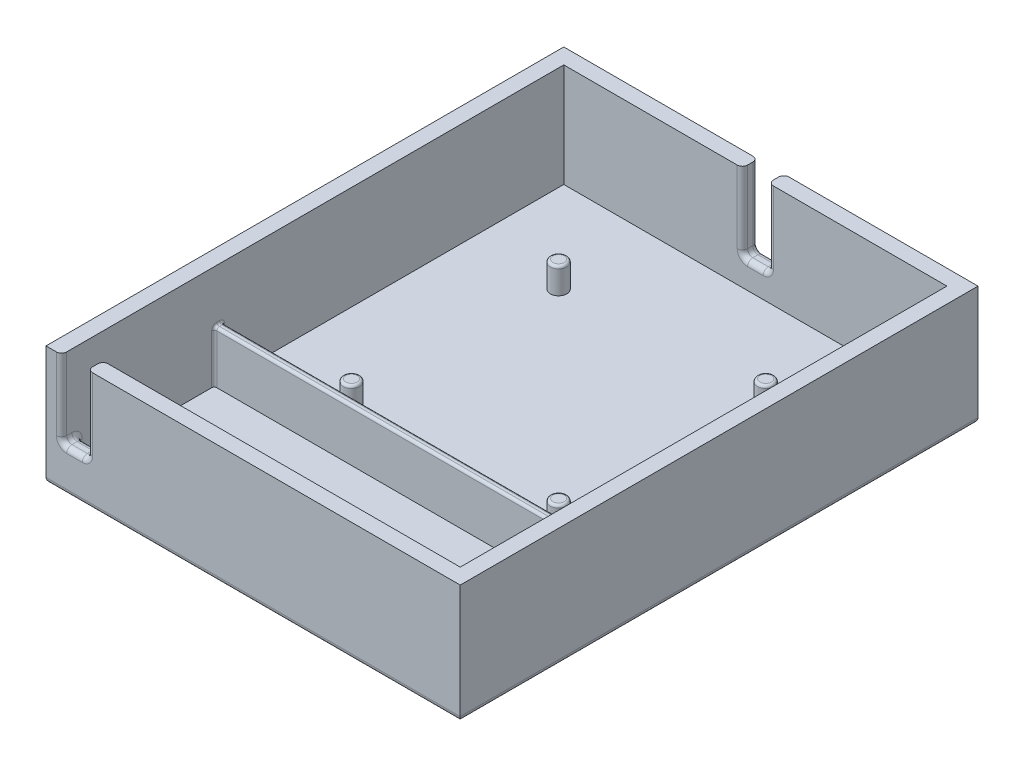
from build123d import *

# Parameters (mm, degrees)
SKETCH1_W           = 80
SKETCH1_H           = 100
BOSS_EXTRUDE1_DEPTH = 3
SKETCH2_W           = 80
SKETCH2_H           = 100
SKETCH2_W_2         = 74
SKETCH2_H_2         = 94
BOSS_EXTRUDE2_DEPTH = 20
SKETCH3_R           = 1.6
BOSS_EXTRUDE3_DEPTH = 5
SKETCH4_W           = 74
SKETCH4_H           = 1.5
BOSS_EXTRUDE4_DEPTH = 10
SKETCH6_W           = 5
SKETCH6_H           = 3
SKETCH6_H_2         = 8.17035569
CUT_EXTRUDE1_DEPTH  = 15
FILLET1_R           = 1
FILLET2_R           = 0.5
FILLET3_R           = 1


with BuildPart() as part:
    # Sketch1 → Boss-Extrude1 (new body)
    with BuildSketch(Plane(origin=(0, 0, 0), x_dir=(1, 0, 0), z_dir=(0, 1, 0))):
        Rectangle(SKETCH1_W, SKETCH1_H)
    extrude(amount=BOSS_EXTRUDE1_DEPTH)

    # Sketch2 → Boss-Extrude2 (add)
    with BuildSketch(Plane(origin=(0, 3, 0), x_dir=(1, 0, 0), z_dir=(0, 1, 0))):
        Rectangle(SKETCH2_W, SKETCH2_H)
        Rectangle(SKETCH2_W_2, SKETCH2_H_2, mode=Mode.SUBTRACT)
    extrude(amount=BOSS_EXTRUDE2_DEPTH)

    # Sketch3 → Boss-Extrude3 (add)
    with BuildSketch(Plane(origin=(0, 3, 0), x_dir=(1, 0, 0), z_dir=(0, 1, 0))):
        with Locations(Location((-20, 29, 0), (0, 0, 270))):
            Circle(SKETCH3_R)
        with Locations(Location((-20, -11, 0), (0, 0, 270))):
            Circle(SKETCH3_R)
        with Locations(Location((20, -11, 0), (0, 0, 90))):
            Circle(SKETCH3_R)
        with Locations(Location((20, 29, 0), (0, 0, 90))):
            Circle(SKETCH3_R)
    extrude(amount=BOSS_EXTRUDE3_DEPTH)

    # Sketch4 → Boss-Extrude4 (add)
    with BuildSketch(Plane(origin=(0, 3, 0), x_dir=(1, 0, 0), z_dir=(0, 1, 0))):
        with Locations((0, -19.75)):
            Rectangle(SKETCH4_W, SKETCH4_H)
    extrude(amount=BOSS_EXTRUDE4_DEPTH)

    # Sketch6 → Cut-Extrude1 (cut)
    with BuildSketch(Plane(origin=(0, 23, 0), x_dir=(1, 0, 0), z_dir=(0, 1, 0))):
        with Locations((-34.5, -48.5)):
            Rectangle(SKETCH6_W, SKETCH6_H)
        with Locations((0, 48.407717635)):
            Rectangle(SKETCH6_W, SKETCH6_H_2)
    extrude(amount=-CUT_EXTRUDE1_DEPTH, mode=Mode.SUBTRACT)

    # Fillet1
    fillet1_edges = [part.edges().sort_by_distance(p)[0] for p in [
        (-37, 5.5, 47),
        (-37, 8, 48.5),
        (-37, 15.5, 50),
        (-34.5, 8, 47),
        (-32, 8, 48.5),
        (-32, 15.5, 47),
        (-34.5, 8, 50),
        (-32, 15.5, 50),
        (0, 8, -47),
        (-2.5, 15.5, -47),
        (2.5, 15.5, -47),
        (2.5, 8, -48.5),
        (2.5, 15.5, -50),
        (-2.5, 15.5, -50),
        (-2.5, 8, -48.5),
        (0, 8, -50),
    ]]
    fillet(fillet1_edges, radius=FILLET1_R)

    # Fillet2
    fillet2_edges = [part.edges().sort_by_distance(p)[0] for p in [
        (-20, 8, -30.6),
        (-20, 8, 9.4),
        (20, 8, 12.6),
        (20, 8, -27.4),
        (-37, 8, 19),
        (-37, 8, 20.5),
        (37, 8, 20.5),
        (37, 8, 19),
        (-37, 13, 19.75),
        (0, 13, 20.5),
        (37, 13, 19.75),
        (0, 13, 19),
    ]]
    fillet(fillet2_edges, radius=FILLET2_R)

    # Fillet3
    fillet3_edges = [part.edges().sort_by_distance(p)[0] for p in [
        (0, 0, 50),
        (-40, 0, 0),
        (0, 0, -50),
        (40, 0, 0),
    ]]
    fillet(fillet3_edges, radius=FILLET3_R)


solid = part.part
